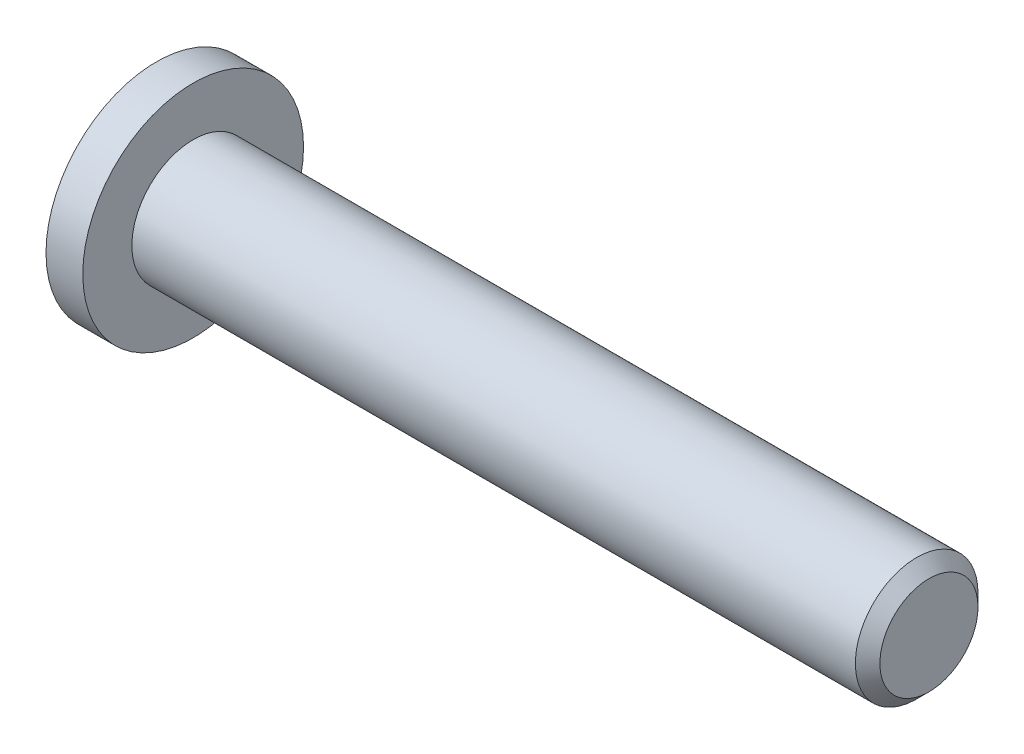
from build123d import *

# Parameters (mm, degrees)
SKETCH1_R     = 4.5
HEAD_DEPTH    = 1.5
SKETCH2_R     = 2.5
BODY_DEPTH    = 30
DRIVE_DEPTH   = 3
CHAMFER1_SIZE = 0.5


with BuildPart() as part:
    # Sketch1 → Head (new body)
    with BuildSketch(Plane(origin=(0, 0, 0), x_dir=(0, 0, -1), z_dir=(1, 0, 0))):
        Circle(SKETCH1_R)
    extrude(amount=HEAD_DEPTH)

    # Sketch2 → Body (add)
    with BuildSketch(Plane(origin=(1.5, 0, 0), x_dir=(0, 0, -1), z_dir=(1, 0, 0))):
        Circle(SKETCH2_R)
    extrude(amount=BODY_DEPTH)

    # Sketch3 → Drive (cut)
    with BuildSketch(Plane.ZY):
        Polygon((0, 1.732050808), (-1.5, 0.866025404), (-1.5, -0.866025404), (0, -1.732050808), (1.5, -0.866025404), (1.5, 0.866025404), align=None)
    extrude(amount=-DRIVE_DEPTH, mode=Mode.SUBTRACT)

    # Chamfer1
    chamfer1_edges = [part.edges().sort_by_distance(p)[0] for p in [
        (31.5, 0, 2.5),
    ]]
    chamfer(chamfer1_edges, length=CHAMFER1_SIZE)


solid = part.part
